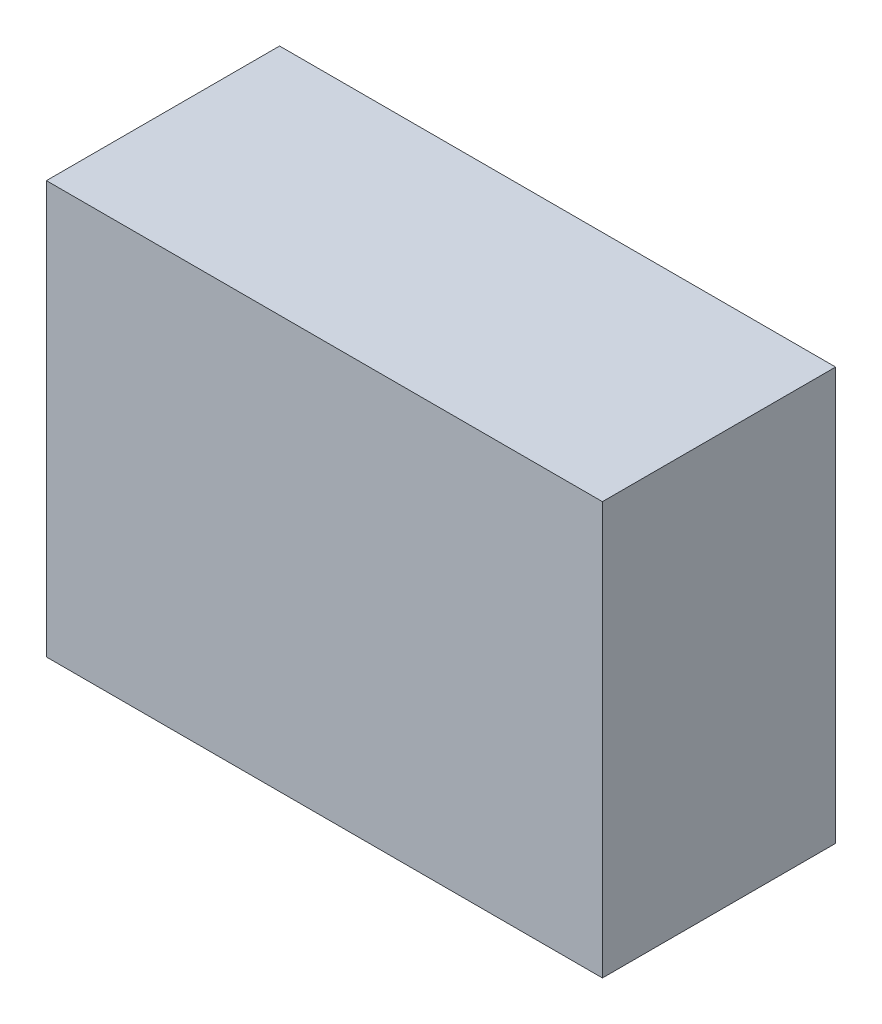
from build123d import *

# Parameters (mm, degrees)
ESBO_O1_W                = 155
ESBO_O1_H                = 115
RESSALTO_EXTRUS_O1_DEPTH = 65
ESBO_O2_W                = 149
ESBO_O2_H                = 109
CORTE_EXTRUS_O1_DEPTH    = 62


with BuildPart() as part:
    # Esboço1 → Ressalto-extrusão1 (new body)
    with BuildSketch(Plane.XY):
        Rectangle(ESBO_O1_W, ESBO_O1_H)
    extrude(amount=RESSALTO_EXTRUS_O1_DEPTH)

    # Esboço2 → Corte-extrusão1 (cut)
    with BuildSketch(Plane(origin=(0, 0, 0), x_dir=(-1, 0, 0), z_dir=(0, 0, -1))):
        Rectangle(ESBO_O2_W, ESBO_O2_H)
    extrude(amount=-CORTE_EXTRUS_O1_DEPTH, mode=Mode.SUBTRACT)


solid = part.part
